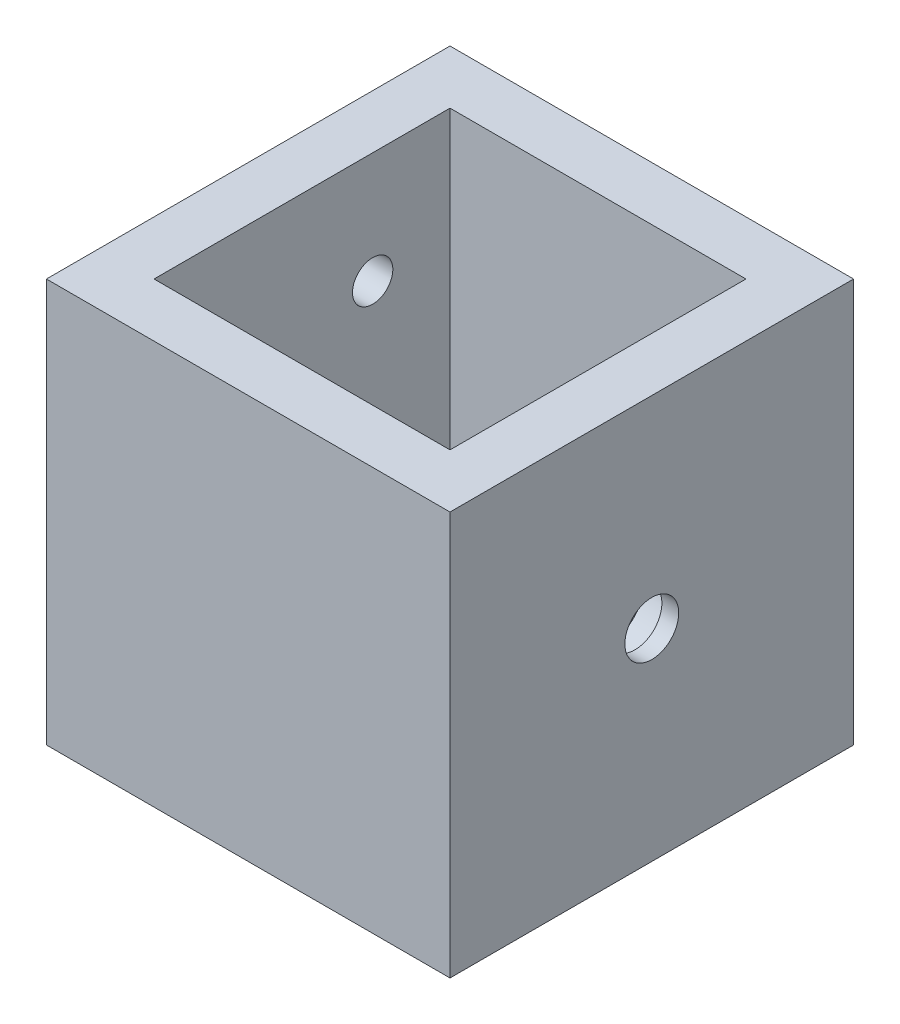
from build123d import *

# Parameters (mm, degrees)
SKETCH1_W           = 60
SKETCH1_H           = 60
BOSS_EXTRUDE1_DEPTH = 60
CUT_EXTRUDE1_DEPTH  = 108
SKETCH2_R           = 4
CUT_EXTRUDE2_DEPTH  = 108
CUT_EXTRUDE3_DEPTH  = 30
SKETCH4_R           = 7.5
CUT_EXTRUDE4_DEPTH  = 5.5


with BuildPart() as part:
    # Sketch1 → Boss-Extrude1 (new body)
    with BuildSketch(Plane(origin=(0, 0, 0), x_dir=(1, 0, 0), z_dir=(0, 1, 0))):
        Rectangle(SKETCH1_W, SKETCH1_H)
    extrude(amount=BOSS_EXTRUDE1_DEPTH)

    # 3DSketch1 → Cut-Extrude1 (cut)
    with BuildSketch(Plane(origin=(-22, 60, -22), x_dir=(0.7071067811865481, 0, 0.707106781186547), z_dir=(0, 1, 0))):
        Polygon((0, 0), (31.112698372, -31.112698372), (62.225396744, 0), (31.112698372, 31.112698372), align=None)
    extrude(amount=-CUT_EXTRUDE1_DEPTH, mode=Mode.SUBTRACT)

    # Sketch2 → Cut-Extrude2 (cut)
    with BuildSketch(Plane.ZY.offset(-22)):
        with Locations((0, 30)):
            Circle(SKETCH2_R)
    extrude(amount=-CUT_EXTRUDE2_DEPTH, mode=Mode.SUBTRACT)

    # Sketch3 → Cut-Extrude3 (cut)
    with BuildSketch(Plane.ZY.offset(30)):
        with BuildLine():
            Line((-10.5, 40.5), (-10.5, 43.5))
            Line((-10.5, 43.5), (-7.5, 43.5))
            ThreePointArc((-7.5, 43.5), (-12.621320344, 45.621320344), (-10.5, 40.5))
        make_face()
        with BuildLine():
            Line((-7.5, 43.5), (-10.5, 43.5))
            Line((-10.5, 43.5), (-10.5, 40.5))
            ThreePointArc((-10.5, 40.5), (-8.378679656, 41.378679656), (-7.5, 43.5))
        make_face()
        with BuildLine():
            ThreePointArc((13.5, 43.5), (10.5, 46.5), (7.5, 43.5))
            Line((7.5, 43.5), (10.5, 43.5))
            Line((10.5, 43.5), (10.5, 40.5))
            ThreePointArc((10.5, 40.5), (12.621320344, 41.378679656), (13.5, 43.5))
        make_face()
        with BuildLine():
            Line((10.5, 43.5), (7.5, 43.5))
            ThreePointArc((7.5, 43.5), (8.378679656, 41.378679656), (10.5, 40.5))
            Line((10.5, 40.5), (10.5, 43.5))
        make_face()
        with BuildLine():
            ThreePointArc((13.5, 16.5), (12.621320344, 18.621320344), (10.5, 19.5))
            Line((10.5, 19.5), (10.5, 16.5))
            Line((10.5, 16.5), (7.5, 16.5))
            ThreePointArc((7.5, 16.5), (10.5, 13.5), (13.5, 16.5))
        make_face()
        with BuildLine():
            Line((10.5, 16.5), (10.5, 19.5))
            ThreePointArc((10.5, 19.5), (8.378679656, 18.621320344), (7.5, 16.5))
            Line((7.5, 16.5), (10.5, 16.5))
        make_face()
        with BuildLine():
            ThreePointArc((-7.5, 16.5), (-8.378679656, 18.621320344), (-10.5, 19.5))
            Line((-10.5, 19.5), (-10.5, 16.5))
            Line((-10.5, 16.5), (-7.5, 16.5))
        make_face()
        with BuildLine():
            Line((-10.5, 16.5), (-10.5, 19.5))
            ThreePointArc((-10.5, 19.5), (-12.621320344, 14.378679656), (-7.5, 16.5))
            Line((-7.5, 16.5), (-10.5, 16.5))
        make_face()
    extrude(amount=-CUT_EXTRUDE3_DEPTH, mode=Mode.SUBTRACT)

    # Sketch4 → Cut-Extrude4 (cut)
    with BuildSketch(Plane.ZY.offset(-22)):
        with Locations((0, 30)):
            Circle(SKETCH4_R)
    extrude(amount=-CUT_EXTRUDE4_DEPTH, mode=Mode.SUBTRACT)


solid = part.part
